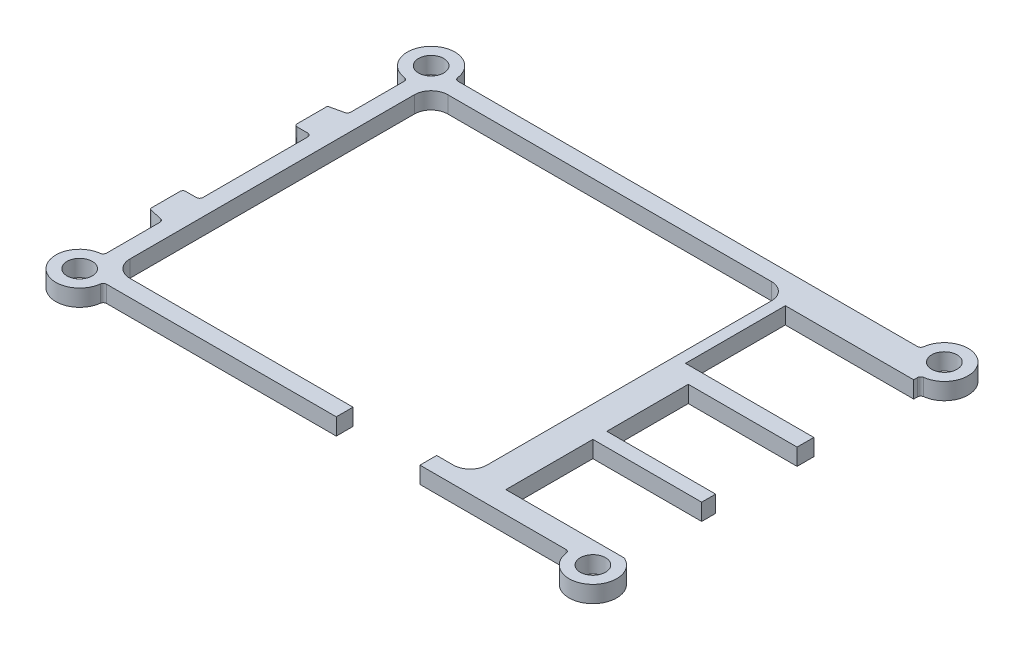
from build123d import *

# Parameters (mm, degrees)
SKETCH1_R           = 2.265
BOSS_EXTRUDE1_DEPTH = 3
SKETCH2_W           = 6.5
SKETCH2_H           = 20
CUT_EXTRUDE1_DEPTH  = 3
BOSS_EXTRUDE2_DEPTH = 3
CUT_EXTRUDE2_DEPTH  = 3
SKETCH5_W           = 3
SKETCH5_H           = 20
BOSS_EXTRUDE3_DEPTH = 3
SKETCH6_W           = 27.010134686
SKETCH6_H           = 17.9
CUT_EXTRUDE3_DEPTH  = 3
SKETCH7_W           = 19.5
SKETCH7_H           = 14.6
CUT_EXTRUDE4_DEPTH  = 3
SKETCH8_W           = 19.5
SKETCH8_H           = 15.6
CUT_EXTRUDE5_DEPTH  = 3
SKETCH9_W           = 2.019620965
SKETCH9_H           = 0.574286347
CUT_EXTRUDE6_DEPTH  = 3
SKETCH10_W          = 15
SKETCH10_H          = 3
CUT_EXTRUDE7_DEPTH  = 3
FILLET1_R           = 0.6


with BuildPart() as part:
    # Sketch1 → Boss-Extrude1 (new body)
    with BuildSketch(Plane(origin=(0, 0, 0), x_dir=(1, 0, 0), z_dir=(0, 1, 0))):
        with BuildLine():
            Line((4.265, 0), (87.735, 0))
            ThreePointArc((87.735, 0), (95.015810422, 3.015810422), (92, -4.265))
            Line((92, -4.265), (92, -58.735))
            ThreePointArc((92, -58.735), (95.015810422, -66.015810422), (87.735, -63))
            Line((87.735, -63), (4.265, -63))
            ThreePointArc((4.265, -63), (-3.015810422, -66.015810422), (0, -58.735))
            Line((0, -58.735), (0, -4.265))
            ThreePointArc((0, -4.265), (-3.015810422, 3.015810422), (4.265, 0))
        make_face()
        with Locations(Location((0, 0, 0), (0, 0, 270))):
            Circle(SKETCH1_R, mode=Mode.SUBTRACT)
        with Locations(Location((92, 0, 0), (0, 0, 270))):
            Circle(SKETCH1_R, mode=Mode.SUBTRACT)
        with Locations(Location((92, -63, 0), (0, 0, 270))):
            Circle(SKETCH1_R, mode=Mode.SUBTRACT)
        with Locations(Location((0, -63, 0), (0, 0, 270))):
            Circle(SKETCH1_R, mode=Mode.SUBTRACT)
    extrude(amount=BOSS_EXTRUDE1_DEPTH)

    # Sketch2 → Cut-Extrude1 (cut)
    with BuildSketch(Plane(origin=(0, 3, 0), x_dir=(1, 0, 0), z_dir=(0, 1, 0))):
        with Locations((3.25, -31.5)):
            Rectangle(SKETCH2_W, SKETCH2_H)
    extrude(amount=-CUT_EXTRUDE1_DEPTH, mode=Mode.SUBTRACT)

    # Sketch3 → Boss-Extrude2 (add)
    with BuildSketch(Plane(origin=(0, 3, 0), x_dir=(1, 0, 0), z_dir=(0, 1, 0))):
        with BuildLine():
            Line((-2.7, -15.5), (0, -14.9))
            Line((0, -14.9), (0, -21.5))
            Line((0, -21.5), (-2.5, -21.5))
            ThreePointArc((-2.5, -21.5), (-2.853553391, -21.353553391), (-3, -21))
            Line((-3, -21), (-3, -15.8))
            ThreePointArc((-3, -15.8), (-2.912132034, -15.587867966), (-2.7, -15.5))
        make_face()
        with BuildLine():
            Line((-3, -42), (-3, -47.2))
            ThreePointArc((-3, -47.2), (-2.912132034, -47.412132034), (-2.7, -47.5))
            Line((-2.7, -47.5), (0, -48.1))
            Line((0, -48.1), (0, -41.5))
            Line((0, -41.5), (-2.5, -41.5))
            ThreePointArc((-2.5, -41.5), (-2.853553391, -41.646446609), (-3, -42))
        make_face()
    extrude(amount=-BOSS_EXTRUDE2_DEPTH)

    # Sketch4 → Cut-Extrude2 (cut)
    with BuildSketch(Plane(origin=(0, 3, 0), x_dir=(1, 0, 0), z_dir=(0, 1, 0))):
        with BuildLine():
            Line((6, -3), (64, -3))
            ThreePointArc((64, -3), (66.121320344, -3.878679656), (67, -6))
            Line((67, -6), (67, -57))
            ThreePointArc((67, -57), (66.121320344, -59.121320344), (64, -60))
            Line((64, -60), (6, -60))
            ThreePointArc((6, -60), (3.878679656, -59.121320344), (3, -57))
            Line((3, -57), (3, -6))
            ThreePointArc((3, -6), (3.878679656, -3.878679656), (6, -3))
        make_face()
    extrude(amount=-CUT_EXTRUDE2_DEPTH, mode=Mode.SUBTRACT)

    # Sketch5 → Boss-Extrude3 (add)
    with BuildSketch(Plane(origin=(0, 3, 0), x_dir=(1, 0, 0), z_dir=(0, 1, 0))):
        with Locations((1.5, -31.5)):
            Rectangle(SKETCH5_W, SKETCH5_H)
    extrude(amount=-BOSS_EXTRUDE3_DEPTH)

    # Sketch6 → Cut-Extrude3 (cut)
    with BuildSketch(Plane(origin=(0, 3, 0), x_dir=(1, 0, 0), z_dir=(0, 1, 0))):
        with Locations((82.505067343, -14.45)):
            Rectangle(SKETCH6_W, SKETCH6_H)
    extrude(amount=-CUT_EXTRUDE3_DEPTH, mode=Mode.SUBTRACT)

    # Sketch7 → Cut-Extrude4 (cut)
    with BuildSketch(Plane(origin=(0, 3, 0), x_dir=(1, 0, 0), z_dir=(0, 1, 0))):
        with Locations((82.25, -33.7)):
            Rectangle(SKETCH7_W, SKETCH7_H)
    extrude(amount=-CUT_EXTRUDE4_DEPTH, mode=Mode.SUBTRACT)

    # Sketch8 → Cut-Extrude5 (cut)
    with BuildSketch(Plane(origin=(0, 3, 0), x_dir=(1, 0, 0), z_dir=(0, 1, 0))):
        with Locations((82.25, -51.3)):
            Rectangle(SKETCH8_W, SKETCH8_H)
    extrude(amount=-CUT_EXTRUDE5_DEPTH, mode=Mode.SUBTRACT)

    # Sketch9 → Cut-Extrude6 (cut)
    with BuildSketch(Plane(origin=(0, 3, 0), x_dir=(1, 0, 0), z_dir=(0, 1, 0))):
        with Locations((93.009810483, -58.812856827)):
            Rectangle(SKETCH9_W, SKETCH9_H)
    extrude(amount=-CUT_EXTRUDE6_DEPTH, mode=Mode.SUBTRACT)

    # Sketch10 → Cut-Extrude7 (cut)
    with BuildSketch(Plane(origin=(0, 3, 0), x_dir=(1, 0, 0), z_dir=(0, 1, 0))):
        with Locations((53.5, -61.5)):
            Rectangle(SKETCH10_W, SKETCH10_H)
    extrude(amount=-CUT_EXTRUDE7_DEPTH, mode=Mode.SUBTRACT)

    # Fillet1
    fillet1_edges = [part.edges().sort_by_distance(p)[0] for p in [
        (0, 1.5, 41.5),
        (92, 1.5, 4.265),
        (0, 1.5, 21.5),
        (87.735, 1.5, 63),
        (4.265, 1.5, 63),
        (0, 1.5, 58.735),
        (0, 1.5, 4.265),
        (4.265, 1.5, 0),
        (87.735, 1.5, 0),
        (93.726332818, 1.5, 59.1),
        (0, 1.5, 14.9),
        (0, 1.5, 48.1),
    ]]
    fillet(fillet1_edges, radius=FILLET1_R)


solid = part.part
